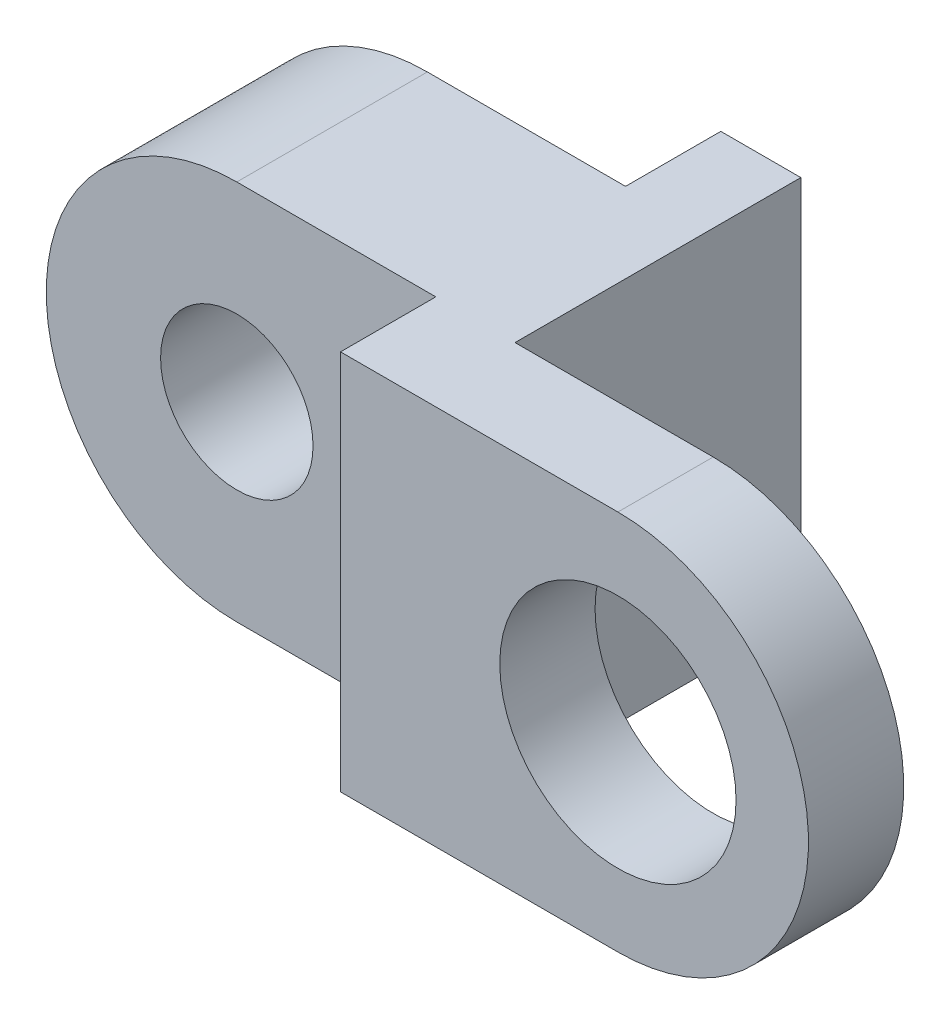
from build123d import *

# Parameters (mm, degrees)
EXTRUDE_1_DEPTH     = 10
SKETCH_3_W          = 5
SKETCH_3_H          = 2.5
CUT_EXTRUDE_2_DEPTH = 19.071040369
SKETCH_4_W          = 10.2
SKETCH_4_H          = 2.5
SKETCH_4_W_2        = 10.22157303
SKETCH_4_H_2        = 7.5
CUT_EXTRUDE_3_DEPTH = 19.071040369
EXTRUDE_START       = -1.5
SKETCH_2_R          = 2
EXTRUDE_2_DEPTH     = 3
SKETCH_2_3_R        = 2
SKETCH_2_3_R_2      = 3.1
CUT_EXTRUDE_4_DEPTH = 16.860721926


with BuildPart() as part:
    # 草圖1 → 填料-伸長1 (new body)
    with BuildSketch(Plane.XY):
        with BuildLine():
            Line((-6.25, -5), (6.25, -5))
            ThreePointArc((6.25, -5), (11.25, 0), (6.25, 5))
            Line((6.25, 5), (-6.25, 5))
            ThreePointArc((-6.25, 5), (-11.25, 0), (-6.25, -5))
        make_face()
    extrude(amount=EXTRUDE_1_DEPTH)

    # 草圖3 → 除料-伸長2 (cut, through all)
    with BuildSketch(Plane(origin=(0, 5, 0), x_dir=(1, 0, 0), z_dir=(0, 1, 0))):
        with Locations((8.75, -5)):
            Rectangle(SKETCH_3_W, SKETCH_3_H)
    extrude(amount=-CUT_EXTRUDE_2_DEPTH, mode=Mode.SUBTRACT)

    # 草圖4 → 除料-伸長3 (cut, through all)
    with BuildSketch(Plane(origin=(0, 5, 0), x_dir=(1, 0, 0), z_dir=(0, 1, 0))):
        with Locations((-6.15, -1.25)):
            Rectangle(SKETCH_4_W, SKETCH_4_H)
        with Locations((-6.139213485, -8.75)):
            Rectangle(SKETCH_4_W_2, SKETCH_4_H)
        with Locations((6.15, -3.75)):
            Rectangle(SKETCH_4_W, SKETCH_4_H_2)
    extrude(amount=-CUT_EXTRUDE_3_DEPTH, mode=Mode.SUBTRACT)

    # 草圖2 → 填料-伸長2 (add)
    with BuildSketch(Plane.XY.offset(10).offset(EXTRUDE_START)):
        with Locations((-6.25, 0)):
            Circle(SKETCH_2_R)
    extrude(amount=-EXTRUDE_2_DEPTH)

    # 草圖2<3> → 除料-伸長4 (cut, through all)
    with BuildSketch(Plane.XY.offset(10)):
        with Locations((-6.25, 0)):
            Circle(SKETCH_2_3_R)
        with Locations((6.25, 0)):
            Circle(SKETCH_2_3_R_2)
    extrude(amount=-CUT_EXTRUDE_4_DEPTH, mode=Mode.SUBTRACT)


solid = part.part
